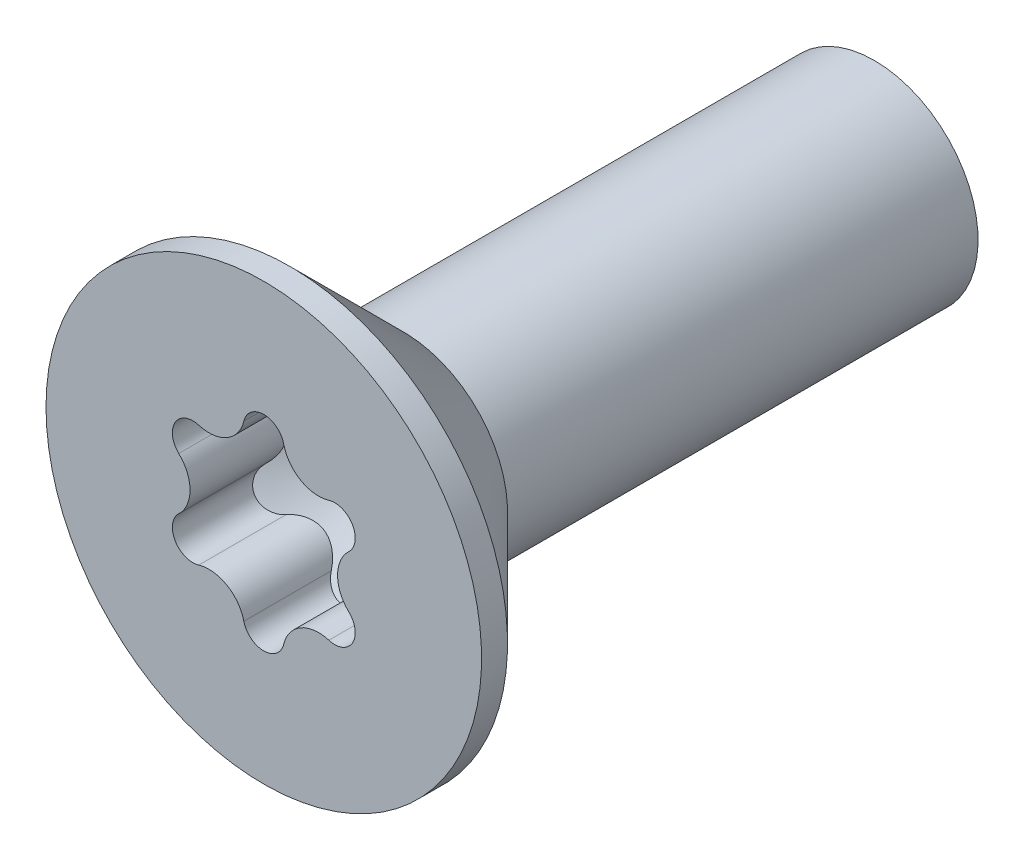
from build123d import *

# Parameters (mm, degrees)
HEXALOBULAR_REACH = 15.39


with BuildPart() as part:
    # BodySke → Base-Revolve (revolve)
    with BuildSketch(Plane(origin=(0, 0, 0), x_dir=(0, 0, -1), z_dir=(1, 0, 0)), mode=Mode.PRIVATE) as base_revolve_sk:
        Polygon((0, 0), (0, 4.2), (0.5, 4.2), (2.7, 2), (12, 2), (12, 0), align=None)
    revolve(base_revolve_sk.sketch.rotate(Axis((0, 0, 0), (0, 0, 1)), 90), axis=Axis((0, 0, 0), (0, 0, 1)))

    # PreBSke → PreBroach (revolve, cut)
    with BuildSketch(Plane(origin=(0, 0, 0), x_dir=(0, 0, -1), z_dir=(1, 0, 0)), mode=Mode.PRIVATE) as prebroach_sk:
        Polygon((0, 0), (0, 1.975), (1.53, 1.975), (2.716699723, 0), align=None)
    revolve(prebroach_sk.sketch.rotate(Axis((0, 0, 0), (0, 0, 1)), 90), axis=Axis((0, 0, 0), (0, 0, 1)), mode=Mode.SUBTRACT)

    # Hexalobular: up to this cone (the profile starts inside it)
    hexalobular_end = Plane(origin=(0, 0, 0), z_dir=(0, 0, 1)).offset(-2.716698723) * Cone(1.664e-06, 38.491534639, 23.128046331, align=(Align.CENTER, Align.CENTER, Align.MIN), mode=Mode.PRIVATE)
    # HexSke → Hexalobular (add, up to the surface)
    with BuildSketch(Plane.XY, mode=Mode.PRIVATE) as hexalobular_sk1:
        with BuildLine():
            ThreePointArc((-1.710400172, -0.9875), (-1.759153793, -0.73278065), (-1.639427829, -0.502727273))
            ThreePointArc((-1.639427829, -0.502727273), (-1.422616288, 0), (-1.639427829, 0.502727273))
            ThreePointArc((-1.639427829, 0.502727273), (-1.759153793, 0.73278065), (-1.710400172, 0.9875))
            ThreePointArc((-1.710400172, 0.9875), (-1.975, 0), (-1.710400172, -0.9875))
        make_face()
    hexalobular_tool1 = extrude(hexalobular_sk1.sketch, amount=-HEXALOBULAR_REACH, mode=Mode.PRIVATE) & hexalobular_end
    add(hexalobular_tool1.solids().sort_by_distance((-1.729243, 0, 0))[0])
    # HexSke → Hexalobular (add, up to the surface)
    with BuildSketch(Plane.XY, mode=Mode.PRIVATE) as hexalobular_sk2:
        with BuildLine():
            ThreePointArc((0, 1.975), (-0.9875, 1.710400172), (-1.710400172, 0.9875))
            ThreePointArc((-1.710400172, 0.9875), (-1.514183555, 1.157081549), (-1.255088504, 1.168422511))
            ThreePointArc((-1.255088504, 1.168422511), (-0.711308144, 1.232021846), (-0.384339325, 1.671149784))
            ThreePointArc((-0.384339325, 1.671149784), (-0.244970238, 1.889862199), (0, 1.975))
        make_face()
    hexalobular_tool2 = extrude(hexalobular_sk2.sketch, amount=-HEXALOBULAR_REACH, mode=Mode.PRIVATE) & hexalobular_end
    add(hexalobular_tool2.solids().sort_by_distance((-0.864621, 1.497568, 0))[0])
    # HexSke → Hexalobular (add, up to the surface)
    with BuildSketch(Plane.XY, mode=Mode.PRIVATE) as hexalobular_sk3:
        with BuildLine():
            ThreePointArc((1.710400172, 0.9875), (0.9875, 1.710400172), (0, 1.975))
            ThreePointArc((0, 1.975), (0.244970238, 1.889862199), (0.384339325, 1.671149784))
            ThreePointArc((0.384339325, 1.671149784), (0.711308144, 1.232021846), (1.255088504, 1.168422511))
            ThreePointArc((1.255088504, 1.168422511), (1.514183555, 1.157081549), (1.710400172, 0.9875))
        make_face()
    hexalobular_tool3 = extrude(hexalobular_sk3.sketch, amount=-HEXALOBULAR_REACH, mode=Mode.PRIVATE) & hexalobular_end
    add(hexalobular_tool3.solids().sort_by_distance((0.864621, 1.497568, 0))[0])
    # HexSke → Hexalobular (add, up to the surface)
    with BuildSketch(Plane.XY, mode=Mode.PRIVATE) as hexalobular_sk4:
        with BuildLine():
            ThreePointArc((1.639427829, -0.502727273), (1.759153793, -0.73278065), (1.710400172, -0.9875))
            ThreePointArc((1.710400172, -0.9875), (1.907703507, -0.511167614), (1.975, 0))
            ThreePointArc((1.975, 0), (1.907703507, 0.511167614), (1.710400172, 0.9875))
            ThreePointArc((1.710400172, 0.9875), (1.759153793, 0.73278065), (1.639427829, 0.502727273))
            ThreePointArc((1.639427829, 0.502727273), (1.422616288, 0), (1.639427829, -0.502727273))
        make_face()
    hexalobular_tool4 = extrude(hexalobular_sk4.sketch, amount=-HEXALOBULAR_REACH, mode=Mode.PRIVATE) & hexalobular_end
    add(hexalobular_tool4.solids().sort_by_distance((1.729243, 0, 0))[0])
    # HexSke → Hexalobular (add, up to the surface)
    with BuildSketch(Plane.XY, mode=Mode.PRIVATE) as hexalobular_sk5:
        with BuildLine():
            ThreePointArc((0.384339325, -1.671149784), (0.244970238, -1.889862199), (0, -1.975))
            ThreePointArc((0, -1.975), (0.9875, -1.710400172), (1.710400172, -0.9875))
            ThreePointArc((1.710400172, -0.9875), (1.514183555, -1.157081549), (1.255088504, -1.168422511))
            ThreePointArc((1.255088504, -1.168422511), (0.711308144, -1.232021846), (0.384339325, -1.671149784))
        make_face()
    hexalobular_tool5 = extrude(hexalobular_sk5.sketch, amount=-HEXALOBULAR_REACH, mode=Mode.PRIVATE) & hexalobular_end
    add(hexalobular_tool5.solids().sort_by_distance((0.864621, -1.497568, 0))[0])
    # HexSke → Hexalobular (add, up to the surface)
    with BuildSketch(Plane.XY, mode=Mode.PRIVATE) as hexalobular_sk6:
        with BuildLine():
            ThreePointArc((-1.255088504, -1.168422511), (-1.514183555, -1.157081549), (-1.710400172, -0.9875))
            ThreePointArc((-1.710400172, -0.9875), (-0.9875, -1.710400172), (0, -1.975))
            ThreePointArc((0, -1.975), (-0.244970238, -1.889862199), (-0.384339325, -1.671149784))
            ThreePointArc((-0.384339325, -1.671149784), (-0.711308144, -1.232021846), (-1.255088504, -1.168422511))
        make_face()
    hexalobular_tool6 = extrude(hexalobular_sk6.sketch, amount=-HEXALOBULAR_REACH, mode=Mode.PRIVATE) & hexalobular_end
    add(hexalobular_tool6.solids().sort_by_distance((-0.864621, -1.497568, 0))[0])

    # ThdSchSke → ThreadSchematic (revolve, cut)
    with BuildSketch(Plane(origin=(0, 0, 0), x_dir=(0, 0, -1), z_dir=(1, 0, 0))):
        Polygon((12.225166605, 2), (12, 1.61), (11.774833395, 2), align=None)
    revolve(axis=Axis((0, 0, 0), (0, 0, 1)), mode=Mode.SUBTRACT)


solid = part.part
